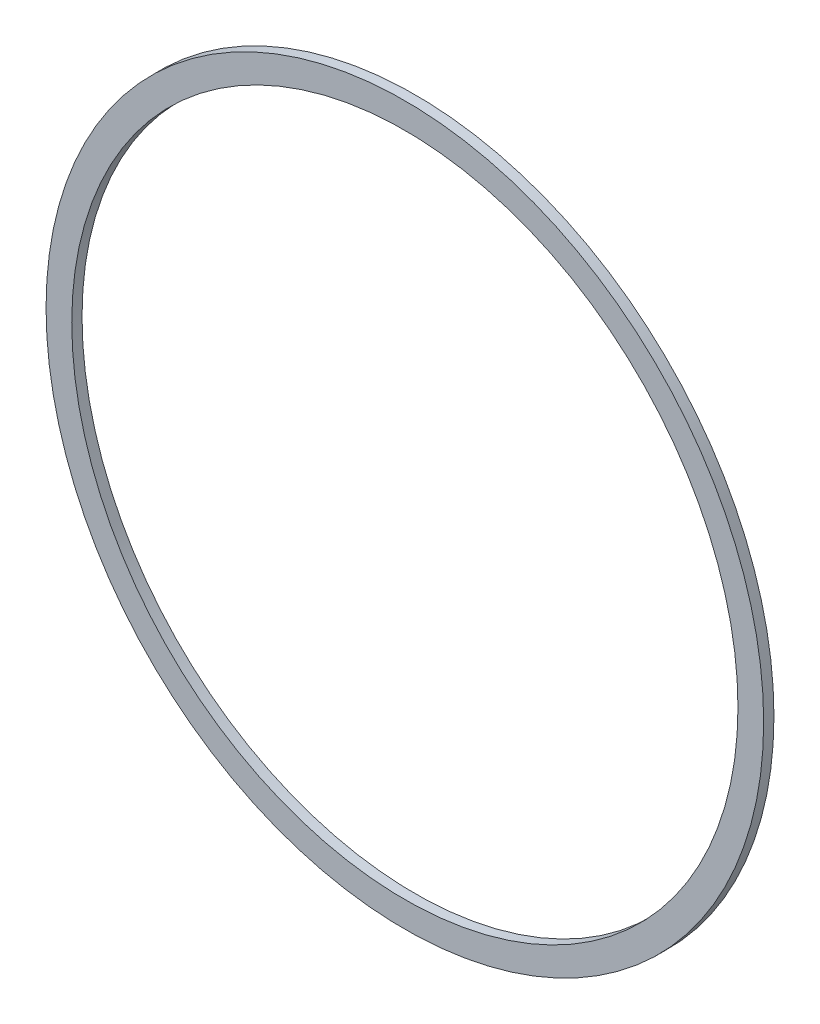
from build123d import *

# Parameters (mm, degrees)
SKETCH1_R           = 69.8
SKETCH1_R_2         = 64.8
BOSS_EXTRUDE1_DEPTH = 2


with BuildPart() as part:
    # Sketch1 → Boss-Extrude1 (new body)
    with BuildSketch(Plane.XY):
        Circle(SKETCH1_R)
        Circle(SKETCH1_R_2, mode=Mode.SUBTRACT)
    extrude(amount=BOSS_EXTRUDE1_DEPTH)


solid = part.part
